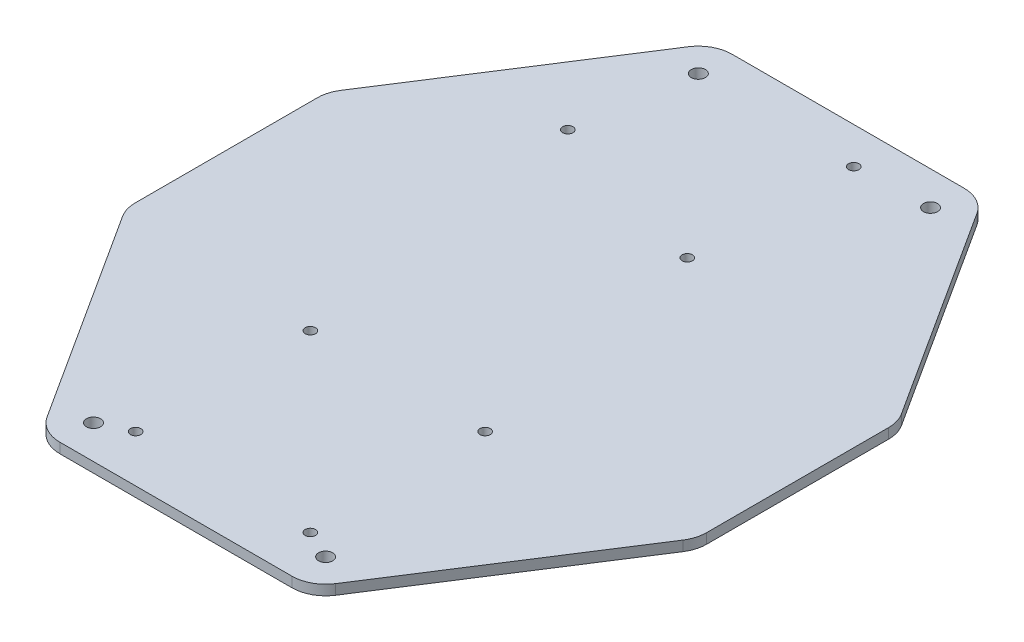
from build123d import *

# Parameters (mm, degrees)
SKETCH_1_R      = 1.55
SKETCH_1_R_2    = 2.1
EXTRUDE_1_DEPTH = 3


with BuildPart() as part:
    # 草图1 → 凸台-拉伸1 (new body)
    with BuildSketch(Plane(origin=(0, 0, 0), x_dir=(1, 0, 0), z_dir=(0, 1, 0))):
        with BuildLine():
            Line((-85, 32.937018863), (-85, 87.062981137))
            ThreePointArc((-85, 87.062981137), (-84.594734169, 89.880972661), (-83.411784754, 92.47055705))
            Line((-83.411784754, 92.47055705), (-42.952272627, 155.407575913))
            ThreePointArc((-42.952272627, 155.407575913), (-39.332368552, 158.777122511), (-34.540487874, 160))
            Line((-34.540487874, 160), (34.540487874, 160))
            ThreePointArc((34.540487874, 160), (39.332368552, 158.777122511), (42.952272627, 155.407575913))
            Line((42.952272627, 155.407575913), (83.411784754, 92.47055705))
            ThreePointArc((83.411784754, 92.47055705), (84.594734169, 89.880972661), (85, 87.062981137))
            Line((85, 87.062981137), (85, 32.937018863))
            ThreePointArc((85, 32.937018863), (84.594734169, 30.119027339), (83.411784754, 27.52944295))
            Line((83.411784754, 27.52944295), (42.952272627, -35.407575913))
            ThreePointArc((42.952272627, -35.407575913), (39.332368552, -38.777122511), (34.540487874, -40))
            Line((34.540487874, -40), (-34.540487874, -40))
            ThreePointArc((-34.540487874, -40), (-39.332368552, -38.777122511), (-42.952272627, -35.407575913))
            Line((-42.952272627, -35.407575913), (-83.411784754, 27.52944295))
            ThreePointArc((-83.411784754, 27.52944295), (-84.594734169, 30.119027339), (-85, 32.937018863))
        make_face()
        with Locations(Location((-26, 26, 0), (0, 0, 270))):
            Circle(SKETCH_1_R, mode=Mode.SUBTRACT)
        with Locations(Location((26, 26, 0), (0, 0, 270))):
            Circle(SKETCH_1_R, mode=Mode.SUBTRACT)
        with Locations(Location((26, -26, 0), (0, 0, 270))):
            Circle(SKETCH_1_R, mode=Mode.SUBTRACT)
        with Locations(Location((-26, -26, 0), (0, 0, 270))):
            Circle(SKETCH_1_R, mode=Mode.SUBTRACT)
        with Locations(Location((-39.5, 116.11, 0), (0, 0, 270))):
            Circle(SKETCH_1_R, mode=Mode.SUBTRACT)
        with Locations(Location((11.3, 100.87, 0), (0, 0, 270))):
            Circle(SKETCH_1_R, mode=Mode.SUBTRACT)
        with Locations(Location((12.57, 149.13, 0), (0, 0, 270))):
            Circle(SKETCH_1_R, mode=Mode.SUBTRACT)
        with Locations(Location((-34.540487874, -30, 0), (0, 0, 270))):
            Circle(SKETCH_1_R_2, mode=Mode.SUBTRACT)
        with Locations(Location((34.540487874, -30, 0), (0, 0, 270))):
            Circle(SKETCH_1_R_2, mode=Mode.SUBTRACT)
        with Locations(Location((34.540487874, 150, 0), (0, 0, 270))):
            Circle(SKETCH_1_R_2, mode=Mode.SUBTRACT)
        with Locations(Location((-34.540487874, 150, 0), (0, 0, 270))):
            Circle(SKETCH_1_R_2, mode=Mode.SUBTRACT)
    extrude(amount=EXTRUDE_1_DEPTH)


solid = part.part
